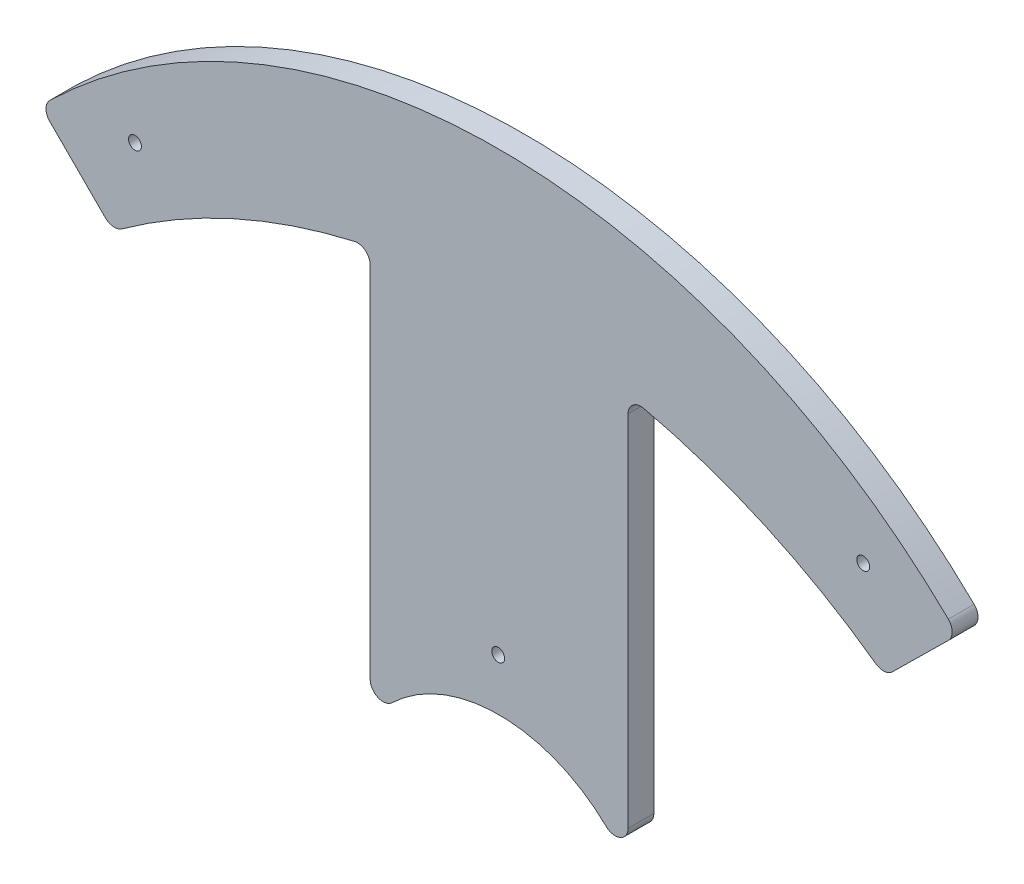
from build123d import *

# Parameters (mm, degrees)
SKETCH1_R           = 1.25
BOSS_EXTRUDE1_DEPTH = 5


with BuildPart() as part:
    # Sketch1 → Boss-Extrude1 (new body)
    with BuildSketch(Plane.XY):
        with BuildLine():
            Line((-14.530655618, 76.440036381), (-14.530655618, 146.054710198))
            ThreePointArc((-14.530655618, 146.054710198), (-13.587367163, 148.010892491), (-11.469336287, 148.490879447))
            ThreePointArc((-11.469336287, 148.490879447), (12.04095694, 140.545885375), (33.518380328, 128.112981328))
            ThreePointArc((33.518380328, 128.112981328), (35.171966674, 127.649015862), (36.734698992, 128.361391788))
            Line((36.734698992, 128.361391788), (47.595476063, 139.069916571))
            ThreePointArc((47.595476063, 139.069916571), (48.340215149, 140.859037128), (47.582728327, 142.642797871))
            ThreePointArc((47.582728327, 142.642797871), (-39.537255282, 178.008774119), (-126.659999819, 142.649599861))
            ThreePointArc((-126.659999819, 142.649599861), (-127.417578865, 140.874623829), (-126.685409475, 139.089016395))
            Line((-126.685409475, 139.089016395), (-115.90638117, 128.309988089))
            ThreePointArc((-115.90638117, 128.309988089), (-114.338855979, 127.585787298), (-112.675804189, 128.050395473))
            ThreePointArc((-112.675804189, 128.050395473), (-91.160542777, 140.523686318), (-67.601782697, 148.490761164))
            ThreePointArc((-67.601782697, 148.490761164), (-65.483745675, 148.010779854), (-64.540453099, 146.054594281))
            Line((-64.540453099, 146.054594281), (-64.540453099, 76.452673847))
            ThreePointArc((-64.540453099, 76.452673847), (-63.02087634, 74.152941195), (-60.309436884, 74.648904776))
            ThreePointArc((-60.309436884, 74.648904776), (-39.533713803, 83.001706864), (-18.762684454, 74.637239634))
            ThreePointArc((-18.762684454, 74.637239634), (-16.050878115, 74.140028546), (-14.530655618, 76.440036381))
        make_face()
        with Locations((-39.71763232, 92.992417004)):
            Circle(SKETCH1_R, mode=Mode.SUBTRACT)
        with Locations((-110.157771622, 143.774581978)):
            Circle(SKETCH1_R, mode=Mode.SUBTRACT)
        with Locations((31.073501699, 143.774581978)):
            Circle(SKETCH1_R, mode=Mode.SUBTRACT)
    extrude(amount=BOSS_EXTRUDE1_DEPTH)


solid = part.part
